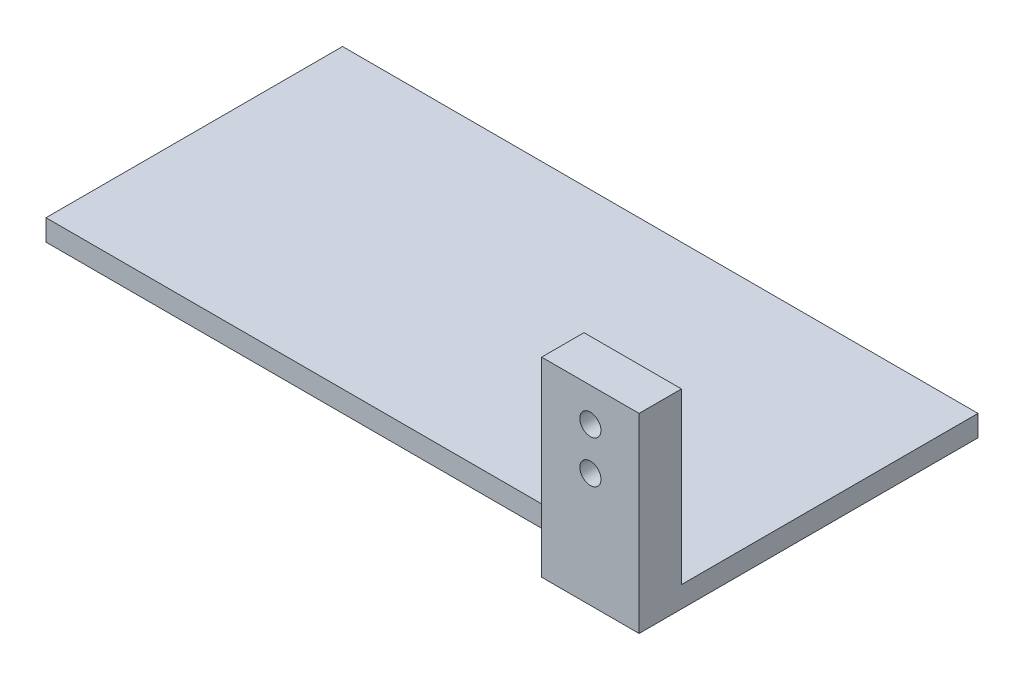
from build123d import *

# Parameters (mm, degrees)
SKETCH2_W           = 23
SKETCH2_H           = 10
BOSS_EXTRUDE1_DEPTH = 40
SKETCH3_R           = 2.5
CUT_EXTRUDE1_DEPTH  = 43.804789452
BOSS_EXTRUDE2_START = -10
SKETCH4_W           = 150
SKETCH4_H           = 5
BOSS_EXTRUDE2_DEPTH = 70
SKETCH5_W           = 23
SKETCH5_H           = 10
BOSS_EXTRUDE3_DEPTH = 5


with BuildPart() as part:
    # Sketch2 → Boss-Extrude1 (new body)
    with BuildSketch(Plane(origin=(0, 0, 0), x_dir=(1, 0, 0), z_dir=(0, 1, 0))):
        Rectangle(SKETCH2_W, SKETCH2_H)
    extrude(amount=BOSS_EXTRUDE1_DEPTH)

    # Sketch3 → Cut-Extrude1 (cut, through all)
    with BuildSketch(Plane.XY.offset(5)):
        with Locations((0, 32)):
            Circle(SKETCH3_R)
        with Locations((0, 22)):
            Circle(SKETCH3_R)
    extrude(amount=-CUT_EXTRUDE1_DEPTH, mode=Mode.SUBTRACT)



with BuildPart() as body_2:
    # Sketch4 → Boss-Extrude2 (new body)
    with BuildSketch(Plane.XY.offset(5).offset(BOSS_EXTRUDE2_START)):
        with Locations((-63.5, -2.5)):
            Rectangle(SKETCH4_W, SKETCH4_H)
    extrude(amount=-BOSS_EXTRUDE2_DEPTH)


with BuildPart() as part_1:
    add(part.part)

    add(body_2.part)  # Boss-Extrude3 merges body 2
    # Sketch5 → Boss-Extrude3 (add)
    with BuildSketch(Plane.XZ):
        Rectangle(SKETCH5_W, SKETCH5_H)
    extrude(amount=BOSS_EXTRUDE3_DEPTH)


solid = part_1.part
